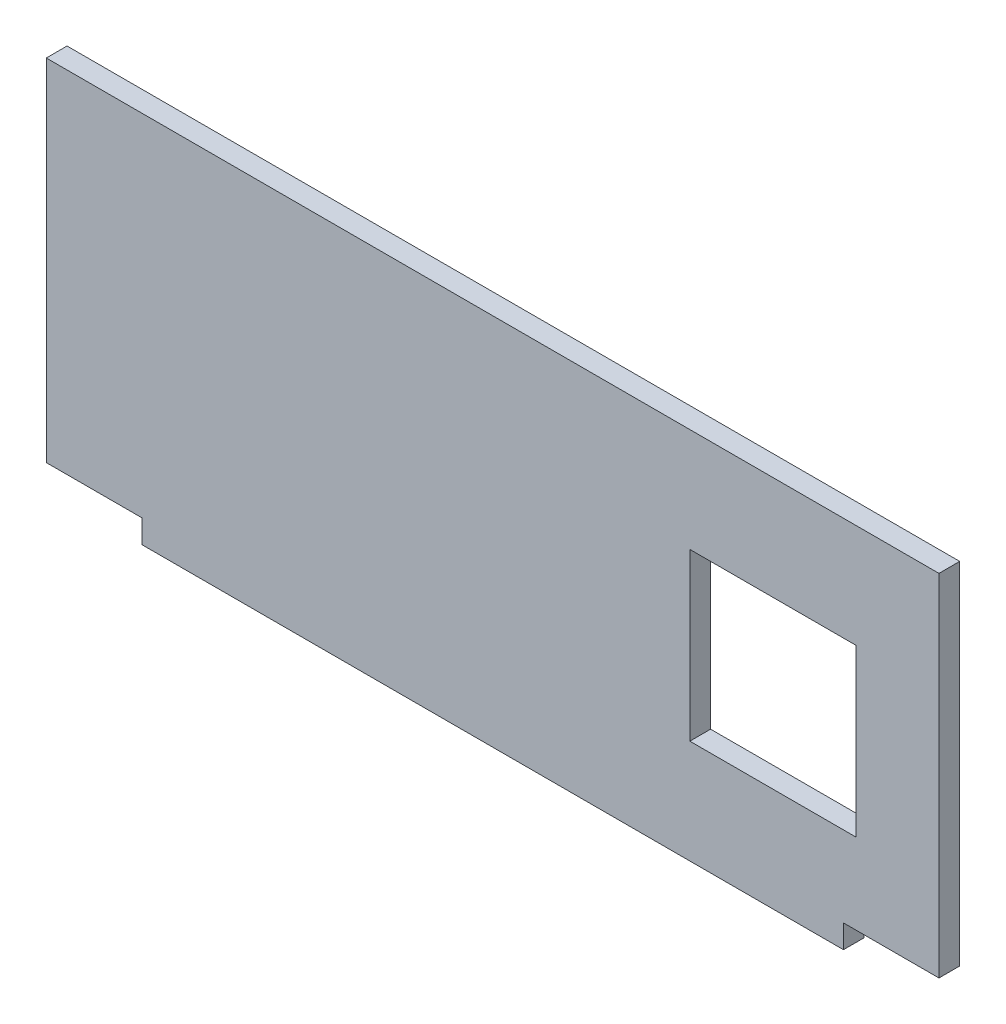
from build123d import *

# Parameters (mm, degrees)
ESQUISSE1_W             = 430
ESQUISSE1_H             = 180
BOSS_EXTRU_1_DEPTH      = 10
ESQUISSE2_W             = 80
ESQUISSE2_H             = 80
ENL_V_MAT_EXTRU_1_DEPTH = 10
ESQUISSE4_W             = 46
ESQUISSE4_H             = 11.2
ENL_V_MAT_EXTRU_2_DEPTH = 10


with BuildPart() as part:
    # Esquisse1 → Boss.-Extru.1 (new body)
    with BuildSketch(Plane.XY):
        with Locations((-215, 90)):
            Rectangle(ESQUISSE1_W, ESQUISSE1_H)
    extrude(amount=BOSS_EXTRU_1_DEPTH)

    # Esquisse2 → Enlèv. mat.-Extru.1 (cut)
    with BuildSketch(Plane(origin=(0, 0, 0), x_dir=(-1, 0, 0), z_dir=(0, 0, -1))):
        with Locations((80, 90)):
            Rectangle(ESQUISSE2_W, ESQUISSE2_H)
    extrude(amount=-ENL_V_MAT_EXTRU_1_DEPTH, mode=Mode.SUBTRACT)

    # Esquisse4 → Enlèv. mat.-Extru.2 (cut)
    with BuildSketch(Plane.XY.offset(10)):
        with Locations((-23, 5.6)):
            Rectangle(ESQUISSE4_W, ESQUISSE4_H)
        with Locations((-407, 5.6)):
            Rectangle(ESQUISSE4_W, ESQUISSE4_H)
    extrude(amount=-ENL_V_MAT_EXTRU_2_DEPTH, mode=Mode.SUBTRACT)


solid = part.part
